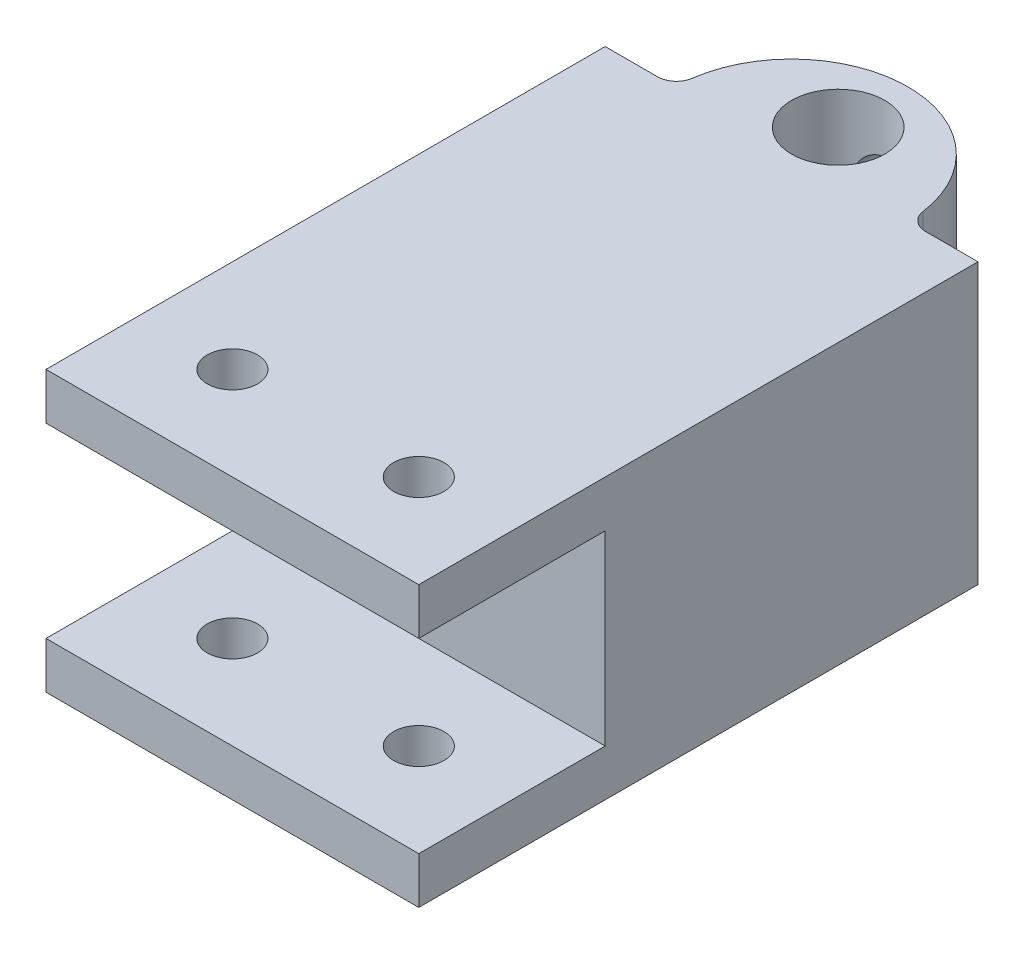
from build123d import *

# Parameters (mm, degrees)
SKETCH1_R           = 6.35
BOSS_EXTRUDE1_DEPTH = 38.1
SKETCH6_W           = 25.4
SKETCH6_H           = 25.4
CUT_EXTRUDE3_DEPTH  = 50.8
SKETCH7_R           = 3.429
CUT_EXTRUDE4_DEPTH  = 71.781852371
FILLET1_R           = 2.54
SKETCH10_R          = 3.429
CUT_EXTRUDE5_DEPTH  = 47.752


with BuildPart() as part:
    # Sketch1 → Boss-Extrude1 (new body)
    with BuildSketch(Plane(origin=(0, 0, 0), x_dir=(1, 0, 0), z_dir=(0, 1, 0))):
        with BuildLine():
            Line((-25.4, 38.1), (-15.875, 38.1))
            ThreePointArc((-15.875, 38.1), (0, 53.975), (15.875, 38.1))
            Line((15.875, 38.1), (25.4, 38.1))
            Line((25.4, 38.1), (25.4, -38.1))
            Line((25.4, -38.1), (-25.4, -38.1))
            Line((-25.4, -38.1), (-25.4, 38.1))
        make_face()
        with Locations(Location((0, 44.45, 0), (0, 0, 270))):
            Circle(SKETCH1_R, mode=Mode.SUBTRACT)
    extrude(amount=-BOSS_EXTRUDE1_DEPTH)

    # Sketch6 → Cut-Extrude3 (cut)
    with BuildSketch(Plane.ZY.offset(25.4)):
        with Locations((25.4, -19.05)):
            Rectangle(SKETCH6_W, SKETCH6_H)
    extrude(amount=-CUT_EXTRUDE3_DEPTH, mode=Mode.SUBTRACT)

    # Sketch7 → Cut-Extrude4 (cut, through all)
    with BuildSketch(Plane(origin=(0, -38.1, 0), x_dir=(-1, 0, 0), z_dir=(0, -1, 0))):
        with Locations(Location((12.7, -25.4, 0), (0, 0, 90))):
            Circle(SKETCH7_R)
        with Locations(Location((-12.7, -25.4, 0), (0, 0, 90))):
            Circle(SKETCH7_R)
    extrude(amount=-CUT_EXTRUDE4_DEPTH, mode=Mode.SUBTRACT)

    # Fillet1
    fillet1_edges = [part.edges().sort_by_distance(p)[0] for p in [
        (-15.875, -19.05, -38.1),
        (15.875, -19.05, -38.1),
    ]]
    fillet(fillet1_edges, radius=FILLET1_R)

    # Sketch10 → Cut-Extrude5 (cut)
    with BuildSketch(Plane.XY.offset(-88.9)):
        with Locations(Location((0, -27.94, 0), (0, 0, 180))):
            Circle(SKETCH10_R)
        with Locations(Location((0, -10.16, 0), (0, 0, 180))):
            Circle(SKETCH10_R)
    extrude(amount=CUT_EXTRUDE5_DEPTH, mode=Mode.SUBTRACT)


solid = part.part
